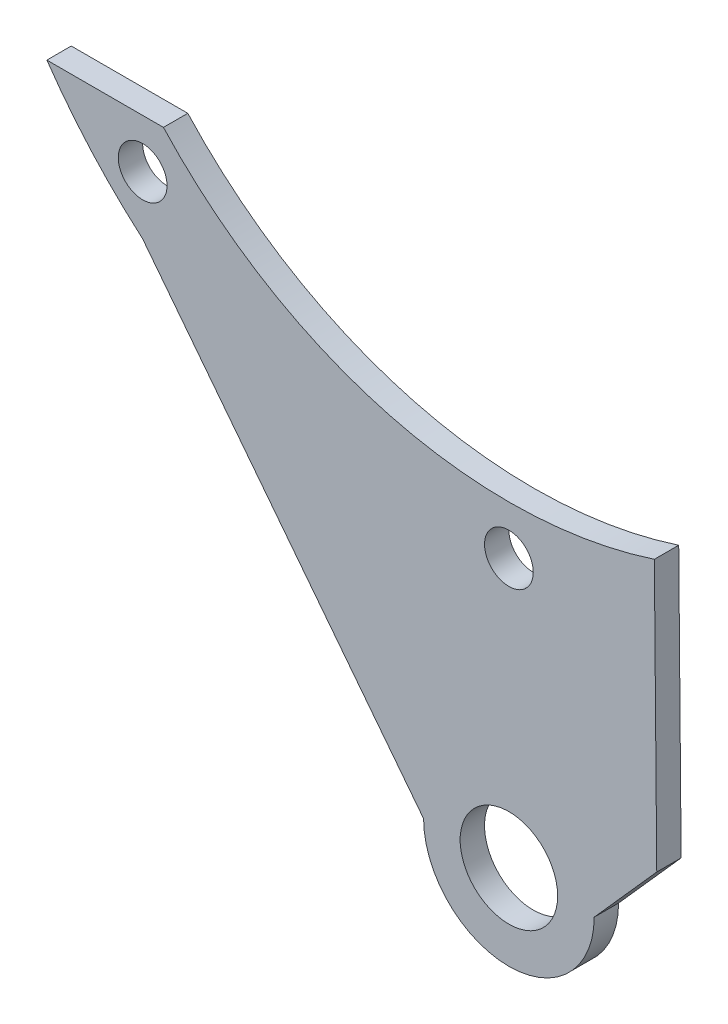
from build123d import *

# Parameters (mm, degrees)
SKETCH_1_R      = 2
SKETCH_1_R_2    = 4
EXTRUDE_1_DEPTH = 2


with BuildPart() as part:
    # 草图1 → 凸台-拉伸1 (new body)
    with BuildSketch(Plane.XY):
        with BuildLine():
            Line((-28.087756532, -25.18156201), (-37.652577321, -25.18156201))
            ThreePointArc((-37.652577321, -25.18156201), (-34.00481141, -29.821346246), (-29.792990581, -33.955878772))
            Line((-29.792990581, -33.955878772), (-6.740952381, -63.62952381))
            ThreePointArc((-6.740952381, -63.62952381), (0.259047619, -70.62952381), (7.259047619, -63.62952381))
            Line((7.259047619, -63.62952381), (12.392004443, -57.856149826))
            Line((12.392004443, -57.856149826), (12.193934029, -35.732918275))
            ThreePointArc((12.193934029, -35.732918275), (-9.496491359, -36.373039477), (-28.087756532, -25.18156201))
        make_face()
        with Locations((0.259047619, -41.62952381)):
            Circle(SKETCH_1_R, mode=Mode.SUBTRACT)
        with Locations((-29.792990581, -29.18156201)):
            Circle(SKETCH_1_R, mode=Mode.SUBTRACT)
        with Locations((0.259047619, -63.62952381)):
            Circle(SKETCH_1_R_2, mode=Mode.SUBTRACT)
    extrude(amount=EXTRUDE_1_DEPTH)


solid = part.part
